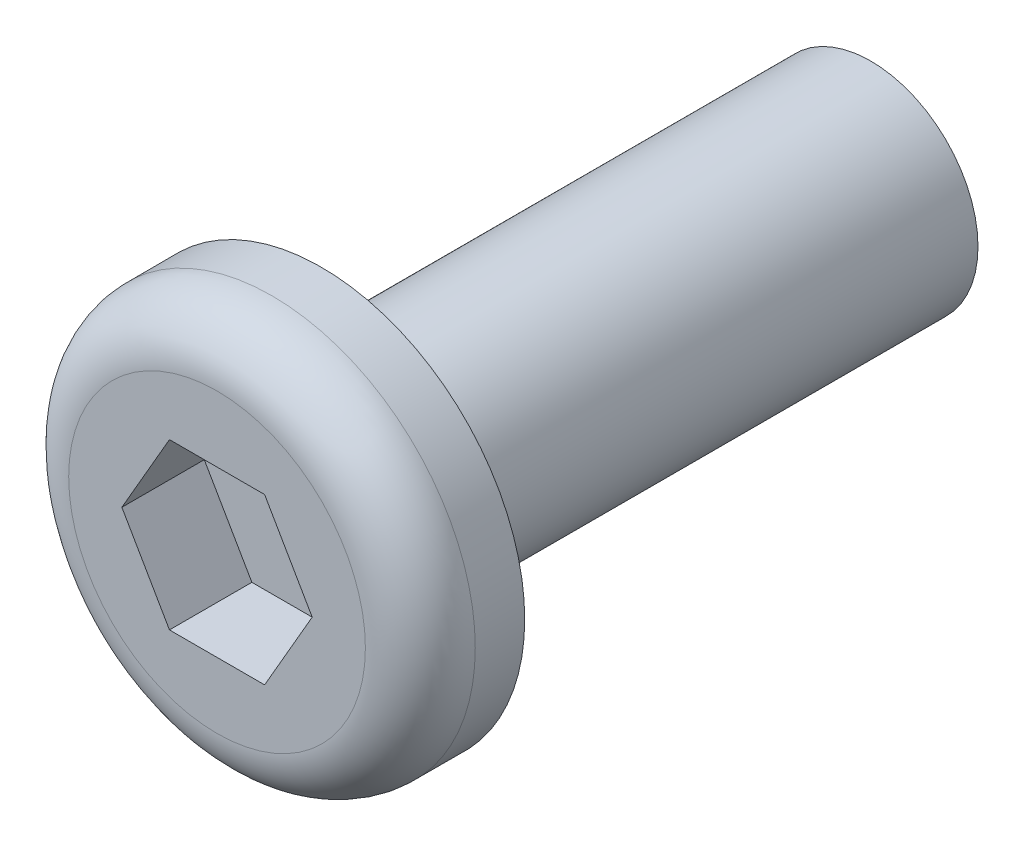
from build123d import *

# Parameters (mm, degrees)
FILLET1_R          = 1
CUT_EXTRUDE1_DEPTH = 1.5


with BuildPart() as part:
    # Sketch1 → Revolve1 (revolve)
    with BuildSketch(Plane(origin=(0, 0, 0), x_dir=(0, 0, -1), z_dir=(1, 0, 0)), mode=Mode.PRIVATE) as revolve1_sk:
        Polygon((1.9, 1.95), (1.9, 3.7), (0, 3.7), (0, 0), (11.9, 0), (11.9, 1.95), align=None)
    revolve(revolve1_sk.sketch.rotate(Axis((0, 0, 0), (0, 0, -1)), 90), axis=Axis((0, 0, 0), (0, 0, -1)))

    # Fillet1
    fillet1_edges = [part.edges().sort_by_distance(p)[0] for p in [
        (-3.7, 0, 0),
    ]]
    fillet(fillet1_edges, radius=FILLET1_R)

    # Sketch2 → Cut-Extrude1 (cut)
    with BuildSketch(Plane.XY):
        Polygon((-1.732050808, 0), (-0.866025404, -1.5), (0.866025404, -1.5), (1.732050808, 0), (0.866025404, 1.5), (-0.866025404, 1.5), align=None)
    extrude(amount=-CUT_EXTRUDE1_DEPTH, mode=Mode.SUBTRACT)


solid = part.part
